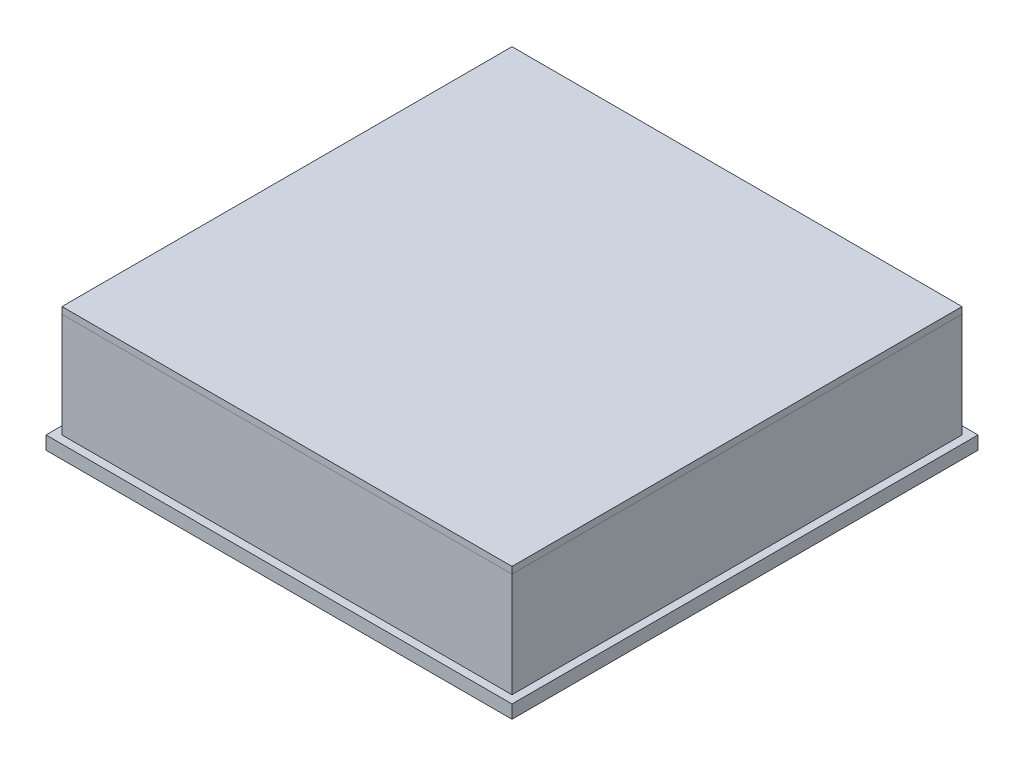
from build123d import *

# Parameters (mm, degrees)
SKETCH2_W           = 8609.584
SKETCH2_H           = 8609.584
SKETCH2_W_2         = 7999.984
SKETCH2_H_2         = 7999.984
BOSS_EXTRUDE1_DEPTH = 1999.996
SKETCH3_W           = 8609.584
SKETCH3_H           = 8609.584
BOSS_EXTRUDE2_DEPTH = 152.4
SKETCH6_W           = 304.8
SKETCH6_H           = 304.8
BOSS_EXTRUDE5_DEPTH = 1999.996
SKETCH7_W           = 8609.584
SKETCH7_H           = 8609.584
BOSS_EXTRUDE6_DEPTH = 127
SKETCH14_W          = 8914.384
SKETCH14_H          = 8914.384
BOSS_EXTRUDE7_DEPTH = 254


with BuildPart() as part:
    # Sketch2 → Boss-Extrude1 (new body)
    with BuildSketch(Plane(origin=(0, 0, 0), x_dir=(1, 0, 0), z_dir=(0, 1, 0))):
        Rectangle(SKETCH2_W, SKETCH2_H)
        Rectangle(SKETCH2_W_2, SKETCH2_H_2, mode=Mode.SUBTRACT)
    extrude(amount=BOSS_EXTRUDE1_DEPTH)

    # Sketch3 → Boss-Extrude2 (add)
    with BuildSketch(Plane.XZ):
        Rectangle(SKETCH3_W, SKETCH3_H)
    extrude(amount=BOSS_EXTRUDE2_DEPTH)

    # Sketch6 → Boss-Extrude5 (add)
    with BuildSketch(Plane(origin=(0, 0, 0), x_dir=(1, 0, 0), z_dir=(0, 1, 0))):
        with Locations((1656.850935784, 1656.850935784)):
            Rectangle(SKETCH6_W, SKETCH6_H)
        with Locations((-1656.850935784, 1656.850935784)):
            Rectangle(SKETCH6_W, SKETCH6_H)
        with Locations((1656.850935784, -1656.850935784)):
            Rectangle(SKETCH6_W, SKETCH6_H)
        with Locations((-1656.850935784, -1656.850935784)):
            Rectangle(SKETCH6_W, SKETCH6_H)
    extrude(amount=BOSS_EXTRUDE5_DEPTH)

    # Sketch14 → Boss-Extrude7 (add)
    with BuildSketch(Plane(origin=(0, 0, 0), x_dir=(1, 0, 0), z_dir=(0, 1, 0))):
        Rectangle(SKETCH14_W, SKETCH14_H)
    extrude(amount=-BOSS_EXTRUDE7_DEPTH)


with BuildPart() as body_2:
    # Sketch7 → Boss-Extrude6 (new body)
    with BuildSketch(Plane(origin=(0, 1999.996, 0), x_dir=(1, 0, 0), z_dir=(0, 1, 0))):
        Rectangle(SKETCH7_W, SKETCH7_H)
    extrude(amount=BOSS_EXTRUDE6_DEPTH)


solid = Compound([part.part, body_2.part])
